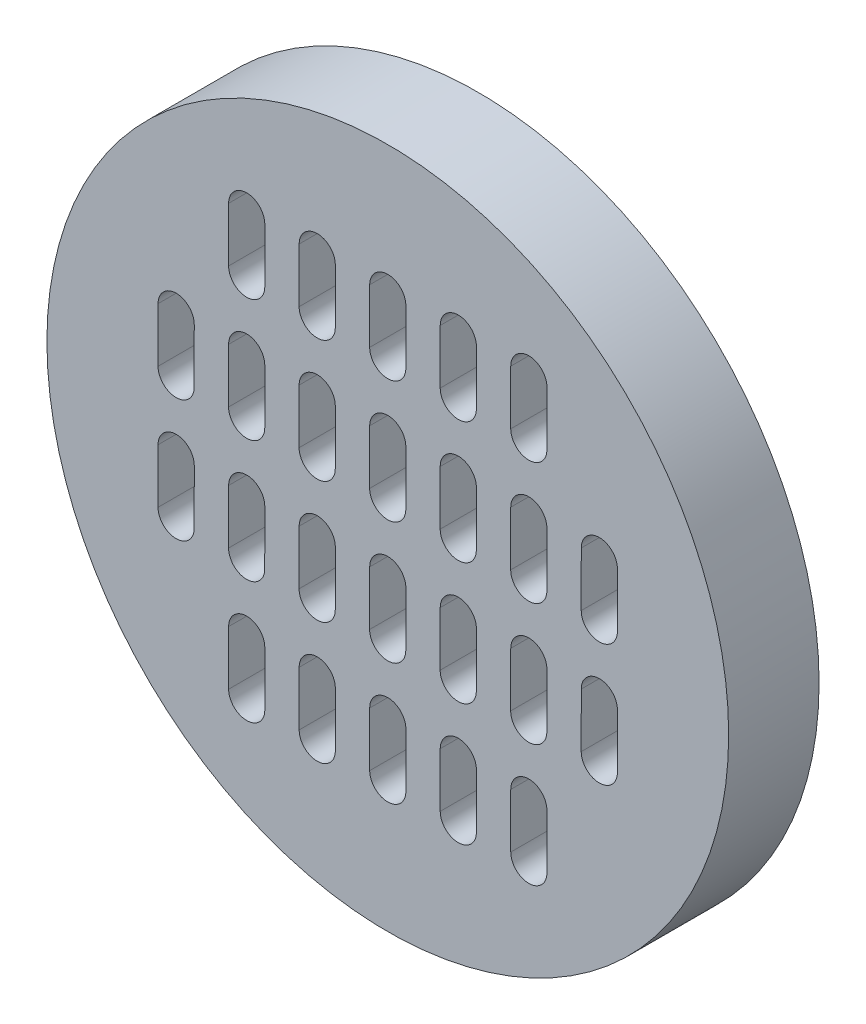
from build123d import *

# Parameters (mm, degrees)
SKETCH2_R           = 18.85
BOSS_EXTRUDE1_DEPTH = 5


with BuildPart() as part:
    # Sketch2 → Boss-Extrude1 (new body)
    with BuildSketch(Plane.XY.offset(10)):
        Circle(SKETCH2_R)
        with BuildLine():
            Line((-6.800750564, 11.632097199), (-6.80194974, 8.632097439))
            ThreePointArc((-6.80194974, 8.632097439), (-7.802349385, 7.632497244), (-8.80194958, 8.632896889))
            Line((-8.80194958, 8.632896889), (-8.800750404, 11.63289665))
            ThreePointArc((-8.800750404, 11.63289665), (-7.800350759, 12.632496845), (-6.800750564, 11.632097199))
        make_face(mode=Mode.SUBTRACT)
        with BuildLine():
            Line((-4.900750404, 11.63289665), (-4.90194958, 8.632896889))
            ThreePointArc((-4.90194958, 8.632896889), (-3.902349385, 7.632497244), (-2.90194974, 8.632097439))
            Line((-2.90194974, 8.632097439), (-2.900750564, 11.632097199))
            ThreePointArc((-2.900750564, 11.632097199), (-3.900350759, 12.632496845), (-4.900750404, 11.63289665))
        make_face(mode=Mode.SUBTRACT)
        with BuildLine():
            Line((-1.000750404, 11.63289665), (-1.00194958, 8.632896889))
            ThreePointArc((-1.00194958, 8.632896889), (-0.002349385, 7.632497244), (0.99805026, 8.632097439))
            Line((0.99805026, 8.632097439), (0.999249436, 11.632097199))
            ThreePointArc((0.999249436, 11.632097199), (-0.000350759, 12.632496845), (-1.000750404, 11.63289665))
        make_face(mode=Mode.SUBTRACT)
        with BuildLine():
            Line((2.899249596, 11.63289665), (2.89805042, 8.632896889))
            ThreePointArc((2.89805042, 8.632896889), (3.897650615, 7.632497244), (4.89805026, 8.632097439))
            Line((4.89805026, 8.632097439), (4.899249436, 11.632097199))
            ThreePointArc((4.899249436, 11.632097199), (3.899649241, 12.632496845), (2.899249596, 11.63289665))
        make_face(mode=Mode.SUBTRACT)
        with BuildLine():
            Line((6.799249596, 11.63289665), (6.79805042, 8.632896889))
            ThreePointArc((6.79805042, 8.632896889), (7.797650615, 7.632497244), (8.79805026, 8.632097439))
            Line((8.79805026, 8.632097439), (8.799249436, 11.632097199))
            ThreePointArc((8.799249436, 11.632097199), (7.799649241, 12.632496845), (6.799249596, 11.63289665))
        make_face(mode=Mode.SUBTRACT)
        with BuildLine():
            Line((-10.703450753, 1.876998531), (-10.7019502, 4.876998531))
            ThreePointArc((-10.7019502, 4.876998531), (-11.701449891, 5.87749859), (-12.70194995, 4.877998899))
            Line((-12.70194995, 4.877998899), (-12.703450502, 1.877998899))
            ThreePointArc((-12.703450502, 1.877998899), (-11.703950811, 0.87749884), (-10.703450753, 1.876998531))
        make_face(mode=Mode.SUBTRACT)
        with BuildLine():
            Line((-8.803450087, 1.877998899), (-8.801949535, 4.877998899))
            ThreePointArc((-8.801949535, 4.877998899), (-7.801449476, 5.87749859), (-6.801949785, 4.876998531))
            Line((-6.801949785, 4.876998531), (-6.803450337, 1.876998531))
            ThreePointArc((-6.803450337, 1.876998531), (-7.803950396, 0.87749884), (-8.803450087, 1.877998899))
        make_face(mode=Mode.SUBTRACT)
        with BuildLine():
            Line((-2.903450337, 1.876998531), (-2.901949785, 4.876998531))
            ThreePointArc((-2.901949785, 4.876998531), (-3.901449476, 5.87749859), (-4.901949535, 4.877998899))
            Line((-4.901949535, 4.877998899), (-4.903450087, 1.877998899))
            ThreePointArc((-4.903450087, 1.877998899), (-3.903950396, 0.87749884), (-2.903450337, 1.876998531))
        make_face(mode=Mode.SUBTRACT)
        with BuildLine():
            Line((0.996549663, 1.876998531), (0.998050215, 4.876998531))
            ThreePointArc((0.998050215, 4.876998531), (-0.001449476, 5.87749859), (-1.001949535, 4.877998899))
            Line((-1.001949535, 4.877998899), (-1.003450087, 1.877998899))
            ThreePointArc((-1.003450087, 1.877998899), (-0.003950396, 0.87749884), (0.996549663, 1.876998531))
        make_face(mode=Mode.SUBTRACT)
        with BuildLine():
            Line((4.896549663, 1.876998531), (4.898050215, 4.876998531))
            ThreePointArc((4.898050215, 4.876998531), (3.898550524, 5.87749859), (2.898050465, 4.877998899))
            Line((2.898050465, 4.877998899), (2.896549913, 1.877998899))
            ThreePointArc((2.896549913, 1.877998899), (3.896049604, 0.87749884), (4.896549663, 1.876998531))
        make_face(mode=Mode.SUBTRACT)
        with BuildLine():
            Line((8.796549663, 1.876998531), (8.798050215, 4.876998531))
            ThreePointArc((8.798050215, 4.876998531), (7.798550524, 5.87749859), (6.798050465, 4.877998899))
            Line((6.798050465, 4.877998899), (6.796549913, 1.877998899))
            ThreePointArc((6.796549913, 1.877998899), (7.796049604, 0.87749884), (8.796549663, 1.876998531))
        make_face(mode=Mode.SUBTRACT)
        with BuildLine():
            Line((12.696549663, 1.876998531), (12.698050215, 4.876998531))
            ThreePointArc((12.698050215, 4.876998531), (11.698550524, 5.87749859), (10.698050465, 4.877998899))
            Line((10.698050465, 4.877998899), (10.696549913, 1.877998899))
            ThreePointArc((10.696549913, 1.877998899), (11.696049604, 0.87749884), (12.696549663, 1.876998531))
        make_face(mode=Mode.SUBTRACT)
        with BuildLine():
            Line((-8.804648151, -4.877758991), (-8.800750032, -1.877758991))
            ThreePointArc((-8.800750032, -1.877758991), (-7.799451504, -0.879059207), (-6.80075172, -1.880357735))
            Line((-6.80075172, -1.880357735), (-6.80464984, -4.880357735))
            ThreePointArc((-6.80464984, -4.880357735), (-7.805948368, -5.879057519), (-8.804648151, -4.877758991))
        make_face(mode=Mode.SUBTRACT)
        with BuildLine():
            Line((-2.90464984, -4.880357735), (-2.90075172, -1.880357735))
            ThreePointArc((-2.90075172, -1.880357735), (-3.899451504, -0.879059207), (-4.900750032, -1.877758991))
            Line((-4.900750032, -1.877758991), (-4.904648151, -4.877758991))
            ThreePointArc((-4.904648151, -4.877758991), (-3.905948368, -5.879057519), (-2.90464984, -4.880357735))
        make_face(mode=Mode.SUBTRACT)
        with BuildLine():
            Line((0.99535016, -4.880357735), (0.99924828, -1.880357735))
            ThreePointArc((0.99924828, -1.880357735), (0.000548496, -0.879059207), (-1.000750032, -1.877758991))
            Line((-1.000750032, -1.877758991), (-1.004648151, -4.877758991))
            ThreePointArc((-1.004648151, -4.877758991), (-0.005948368, -5.879057519), (0.99535016, -4.880357735))
        make_face(mode=Mode.SUBTRACT)
        with BuildLine():
            Line((4.89535016, -4.880357735), (4.89924828, -1.880357735))
            ThreePointArc((4.89924828, -1.880357735), (3.900548496, -0.879059207), (2.899249968, -1.877758991))
            Line((2.899249968, -1.877758991), (2.895351849, -4.877758991))
            ThreePointArc((2.895351849, -4.877758991), (3.894051632, -5.879057519), (4.89535016, -4.880357735))
        make_face(mode=Mode.SUBTRACT)
        with BuildLine():
            Line((8.79535016, -4.880357735), (8.79924828, -1.880357735))
            ThreePointArc((8.79924828, -1.880357735), (7.800548496, -0.879059207), (6.799249968, -1.877758991))
            Line((6.799249968, -1.877758991), (6.795351849, -4.877758991))
            ThreePointArc((6.795351849, -4.877758991), (7.794051632, -5.879057519), (8.79535016, -4.880357735))
        make_face(mode=Mode.SUBTRACT)
        with BuildLine():
            Line((12.69535016, -4.880357735), (12.69924828, -1.880357735))
            ThreePointArc((12.69924828, -1.880357735), (11.700548496, -0.879059207), (10.699249968, -1.877758991))
            Line((10.699249968, -1.877758991), (10.695351849, -4.877758991))
            ThreePointArc((10.695351849, -4.877758991), (11.694051632, -5.879057519), (12.69535016, -4.880357735))
        make_face(mode=Mode.SUBTRACT)
        with BuildLine():
            Line((-10.70464984, -4.880357735), (-10.70075172, -1.880357735))
            ThreePointArc((-10.70075172, -1.880357735), (-11.699451504, -0.879059207), (-12.700750032, -1.877758991))
            Line((-12.700750032, -1.877758991), (-12.704648151, -4.877758991))
            ThreePointArc((-12.704648151, -4.877758991), (-11.705948368, -5.879057519), (-10.70464984, -4.880357735))
        make_face(mode=Mode.SUBTRACT)
        with BuildLine():
            Line((-6.800749353, -8.635615621), (-6.800749353, -11.635615621))
            ThreePointArc((-6.800749353, -11.635615621), (-7.800749353, -12.635615621), (-8.800749353, -11.635615621))
            Line((-8.800749353, -11.635615621), (-8.800749353, -8.635615621))
            ThreePointArc((-8.800749353, -8.635615621), (-7.800749353, -7.635615621), (-6.800749353, -8.635615621))
        make_face(mode=Mode.SUBTRACT)
        with BuildLine():
            Line((-4.900749353, -8.635615621), (-4.900749353, -11.635615621))
            ThreePointArc((-4.900749353, -11.635615621), (-3.900749353, -12.635615621), (-2.900749353, -11.635615621))
            Line((-2.900749353, -11.635615621), (-2.900749353, -8.635615621))
            ThreePointArc((-2.900749353, -8.635615621), (-3.900749353, -7.635615621), (-4.900749353, -8.635615621))
        make_face(mode=Mode.SUBTRACT)
        with BuildLine():
            Line((-1.000749353, -8.635615621), (-1.000749353, -11.635615621))
            ThreePointArc((-1.000749353, -11.635615621), (-0.000749353, -12.635615621), (0.999250647, -11.635615621))
            Line((0.999250647, -11.635615621), (0.999250647, -8.635615621))
            ThreePointArc((0.999250647, -8.635615621), (-0.000749353, -7.635615621), (-1.000749353, -8.635615621))
        make_face(mode=Mode.SUBTRACT)
        with BuildLine():
            Line((2.899250647, -8.635615621), (2.899250647, -11.635615621))
            ThreePointArc((2.899250647, -11.635615621), (3.899250647, -12.635615621), (4.899250647, -11.635615621))
            Line((4.899250647, -11.635615621), (4.899250647, -8.635615621))
            ThreePointArc((4.899250647, -8.635615621), (3.899250647, -7.635615621), (2.899250647, -8.635615621))
        make_face(mode=Mode.SUBTRACT)
        with BuildLine():
            Line((6.799250647, -8.635615621), (6.799250647, -11.635615621))
            ThreePointArc((6.799250647, -11.635615621), (7.799250647, -12.635615621), (8.799250647, -11.635615621))
            Line((8.799250647, -11.635615621), (8.799250647, -8.635615621))
            ThreePointArc((8.799250647, -8.635615621), (7.799250647, -7.635615621), (6.799250647, -8.635615621))
        make_face(mode=Mode.SUBTRACT)
    extrude(amount=BOSS_EXTRUDE1_DEPTH)


solid = part.part
